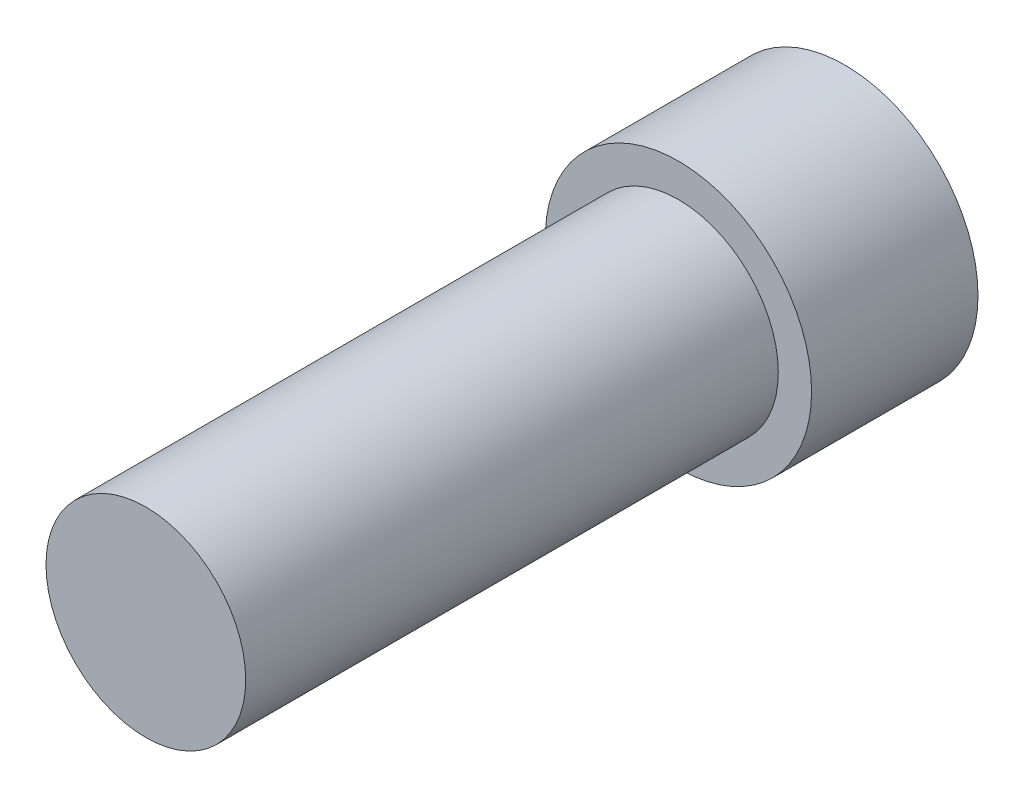
from build123d import *

# Parameters (mm, degrees)
SKETCH_1_R      = 2
EXTRUDE_1_DEPTH = 2.5
SKETCH_2_R      = 1.5
EXTRUDE_2_DEPTH = 8


with BuildPart() as part:
    # 草图1 → 凸台-拉伸1 (new body)
    with BuildSketch(Plane.XY):
        Circle(SKETCH_1_R)
        Polygon((-0.956343023, 1.081083417), (-1.414417215, -0.287675644), (-0.458074192, -1.368759061), (0.956343023, -1.081083417), (1.414417215, 0.287675644), (0.458074192, 1.368759061), align=None, mode=Mode.SUBTRACT)
    extrude(amount=EXTRUDE_1_DEPTH)

    # 草图2 → 凸台-拉伸2 (add)
    with BuildSketch(Plane.XY.offset(2.5)):
        Circle(SKETCH_2_R)
    extrude(amount=EXTRUDE_2_DEPTH)


solid = part.part
